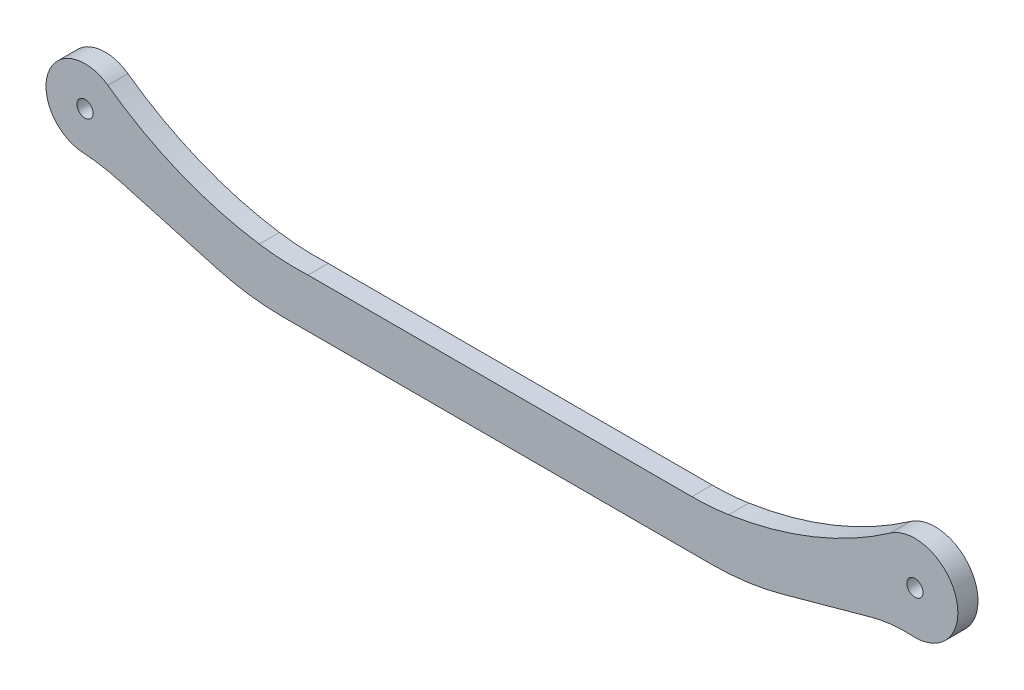
from build123d import *

# Parameters (mm, degrees)
SKETCH1_R           = 2.5
BOSS_EXTRUDE1_DEPTH = 6.2


with BuildPart() as part:
    # Sketch1 → Boss-Extrude1 (new body)
    with BuildSketch(Plane.XY):
        with BuildLine():
            Line((-116.938372425, -13.911569107), (-87, -22.25))
            ThreePointArc((-87, -22.25), (-77.031989093, -24.309319739), (-66.876941087, -25))
            Line((-66.876941087, -25), (65, -25))
            ThreePointArc((65, -25), (75.977025607, -24.261995409), (86.756474933, -22.061265033))
            Line((86.756474933, -22.061265033), (114.235144317, -14.5))
            ThreePointArc((114.235144317, -14.5), (120.463338609, -13.323456153), (126.8, -13.177230394))
            ThreePointArc((126.8, -13.177230394), (140.274563377, 3.600104754), (120, 10.810161116))
            ThreePointArc((120, 10.810161116), (96.313236011, -2.023267975), (70.328890052, -9.134769615))
            ThreePointArc((70.328890052, -9.134769615), (64.680941239, -9.783377892), (59, -10))
            Line((59, -10), (-59, -10))
            ThreePointArc((-59, -10), (-66.518658645, -9.998172905), (-74, -9.25))
            ThreePointArc((-74, -9.25), (-98.410939741, -2.539404949), (-120.554503776, 9.732051233))
            ThreePointArc((-120.554503776, 9.732051233), (-138.868880222, 4.055609252), (-128.349445963, -11.974982784))
            ThreePointArc((-128.349445963, -11.974982784), (-122.593742509, -12.647675527), (-116.938372425, -13.911569107))
        make_face()
        with Locations(Location((127.574986581, 0, 0), (0, 0, 180))):
            Circle(SKETCH1_R, mode=Mode.SUBTRACT)
        with Locations(Location((-127.574986581, 0, 0), (0, 0, 180))):
            Circle(SKETCH1_R, mode=Mode.SUBTRACT)
    extrude(amount=BOSS_EXTRUDE1_DEPTH)


solid = part.part
